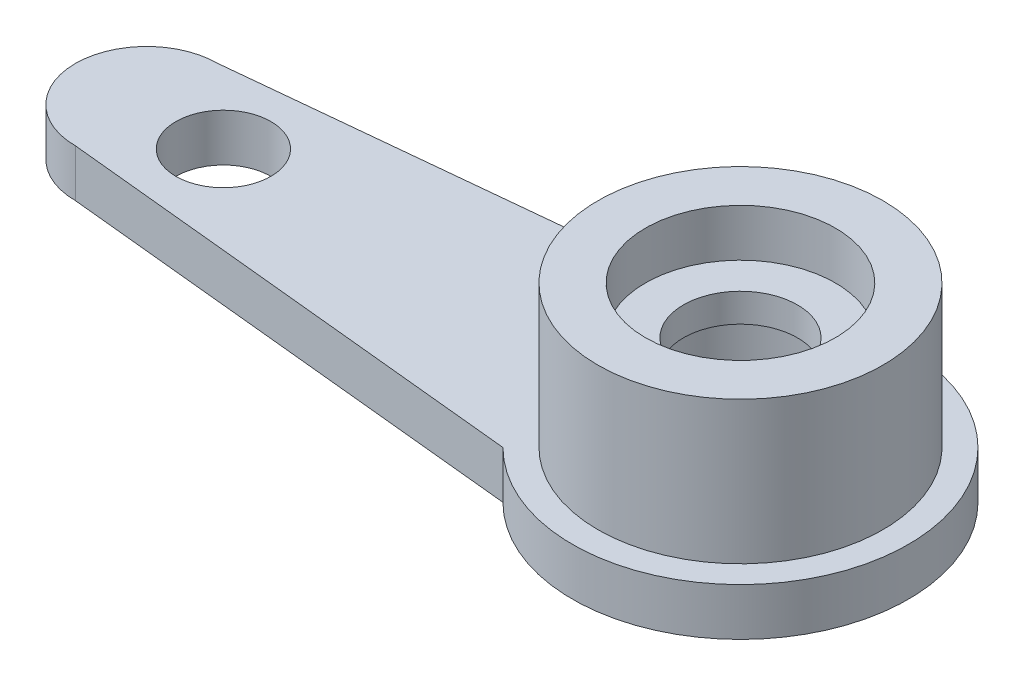
from build123d import *

# Parameters (mm, degrees)
SKETCH1_R           = 10
BOSS_EXTRUDE1_DEPTH = 2.5
SKETCH2_R           = 15
SKETCH2_R_2         = 10
BOSS_EXTRUDE2_DEPTH = 15
SKETCH3_R           = 5
CUT_EXTRUDE1_DEPTH  = 74.739406019
BOSS_EXTRUDE3_START = 9.5
SKETCH4_R           = 10
SKETCH4_R_2         = 6
BOSS_EXTRUDE3_DEPTH = 3


with BuildPart() as part:
    # Sketch1 → Boss-Extrude1 (new, symmetric)
    with BuildSketch(Plane(origin=(0, 0, 0), x_dir=(1, 0, 0), z_dir=(0, 1, 0))):
        with BuildLine():
            Line((-12.5, 12.5), (-62.5, 7.5))
            ThreePointArc((-62.5, 7.5), (-70, 0), (-62.5, -7.5))
            Line((-62.5, -7.5), (-12.5, -12.5))
            ThreePointArc((-12.5, -12.5), (17.67766953, 0), (-12.5, 12.5))
        make_face()
        with Locations(Location((0, 0, 0), (0, 0, 270))):
            Circle(SKETCH1_R, mode=Mode.SUBTRACT)
    extrude(amount=BOSS_EXTRUDE1_DEPTH, both=True)

    # Sketch2 → Boss-Extrude2 (add)
    with BuildSketch(Plane(origin=(0, 2.5, 0), x_dir=(1, 0, 0), z_dir=(0, 1, 0))):
        with Locations(Location((0, 0, 0), (0, 0, 270))):
            Circle(SKETCH2_R)
        with Locations(Location((0, 0, 0), (0, 0, 270))):
            Circle(SKETCH2_R_2, mode=Mode.SUBTRACT)
    extrude(amount=BOSS_EXTRUDE2_DEPTH)

    # Sketch3 → Cut-Extrude1 (cut, through all)
    with BuildSketch(Plane(origin=(0, 2.5, 0), x_dir=(1, 0, 0), z_dir=(0, 1, 0))):
        with Locations(Location((-54.417236445, 0, 0), (0, 0, 270))):
            Circle(SKETCH3_R)
    extrude(amount=-CUT_EXTRUDE1_DEPTH, mode=Mode.SUBTRACT)

    # Sketch4 → Boss-Extrude3 (add)
    with BuildSketch(Plane(origin=(0, 0, 0), x_dir=(1, 0, 0), z_dir=(0, 1, 0)).offset(BOSS_EXTRUDE3_START)):
        with Locations(Location((0, 0, 0), (0, 0, 270))):
            Circle(SKETCH4_R)
        with Locations(Location((0, 0, 0), (0, 0, 270))):
            Circle(SKETCH4_R_2, mode=Mode.SUBTRACT)
    extrude(amount=BOSS_EXTRUDE3_DEPTH)


solid = part.part
